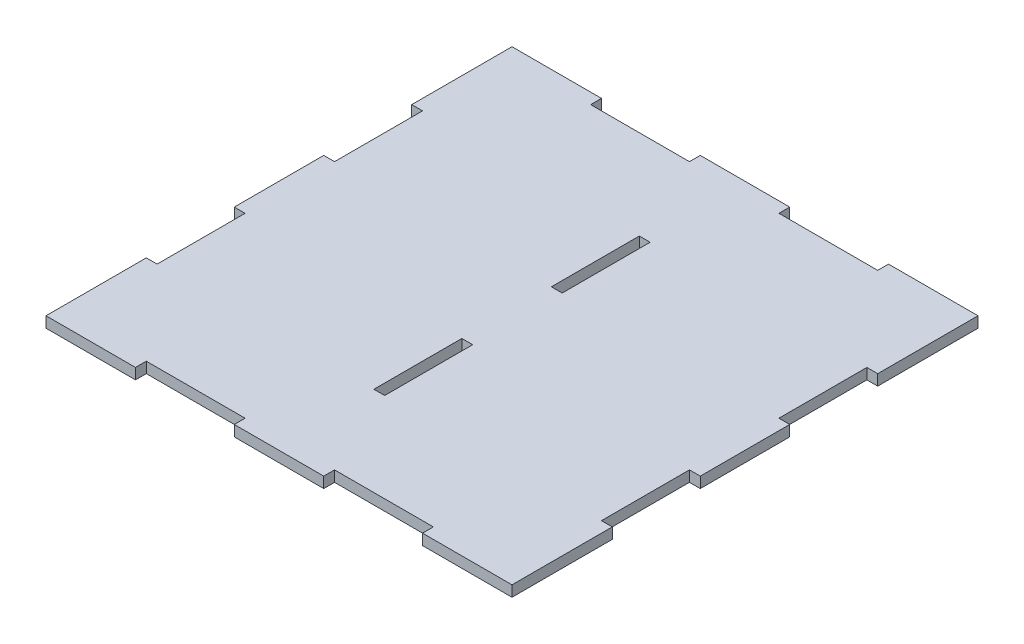
from build123d import *

# Parameters (mm, degrees)
SKETCH_1_W          = 250
SKETCH_1_H          = 250
EXTRUDE_1_DEPTH     = 5.8
CUT_EXTRUDE_1_REACH = 355.601
SKETCH_2_W          = 53
SKETCH_2_H          = 5.8
SKETCH_2_W_2        = 5.8
SKETCH_2_H_2        = 47.2


with BuildPart() as part:
    # Эскиз1 → Бобышка-Вытянуть1 (new body)
    with BuildSketch(Plane(origin=(0, 0, 0), x_dir=(1, 0, 0), z_dir=(0, 1, 0))):
        with Locations((125, 125)):
            Rectangle(SKETCH_1_W, SKETCH_1_H)
    extrude(amount=EXTRUDE_1_DEPTH)

    # Эскиз2 → Вырез-Вытянуть1 (cut, up to next)
    with BuildSketch(Plane.XZ, mode=Mode.PRIVATE) as cut_extrude_1_sk1:
        with Locations((74.5, -2.9)):
            Rectangle(SKETCH_2_W, SKETCH_2_H)
    cut_extrude_1_tool1 = extrude(cut_extrude_1_sk1.sketch, amount=-CUT_EXTRUDE_1_REACH, mode=Mode.PRIVATE) & part.part
    # Эскиз2 → Вырез-Вытянуть1 (cut, up to next)
    with BuildSketch(Plane.XZ, mode=Mode.PRIVATE) as cut_extrude_1_sk2:
        with Locations((175.5, -2.9)):
            Rectangle(SKETCH_2_W, SKETCH_2_H)
    cut_extrude_1_tool2 = extrude(cut_extrude_1_sk2.sketch, amount=-CUT_EXTRUDE_1_REACH, mode=Mode.PRIVATE) & part.part
    # Эскиз2 → Вырез-Вытянуть1 (cut, up to next)
    with BuildSketch(Plane.XZ, mode=Mode.PRIVATE) as cut_extrude_1_sk3:
        with Locations((125, -77.4)):
            Rectangle(SKETCH_2_W_2, SKETCH_2_H_2)
    cut_extrude_1_tool3 = extrude(cut_extrude_1_sk3.sketch, amount=-CUT_EXTRUDE_1_REACH, mode=Mode.PRIVATE) & part.part
    # Эскиз2 → Вырез-Вытянуть1 (cut, up to next)
    with BuildSketch(Plane.XZ, mode=Mode.PRIVATE) as cut_extrude_1_sk4:
        with Locations((2.9, -77.4)):
            Rectangle(SKETCH_2_W_2, SKETCH_2_H_2)
    cut_extrude_1_tool4 = extrude(cut_extrude_1_sk4.sketch, amount=-CUT_EXTRUDE_1_REACH, mode=Mode.PRIVATE) & part.part
    # Эскиз2 → Вырез-Вытянуть1 (cut, up to next)
    with BuildSketch(Plane.XZ, mode=Mode.PRIVATE) as cut_extrude_1_sk5:
        with Locations((2.9, -172.6)):
            Rectangle(SKETCH_2_W_2, SKETCH_2_H_2)
    cut_extrude_1_tool5 = extrude(cut_extrude_1_sk5.sketch, amount=-CUT_EXTRUDE_1_REACH, mode=Mode.PRIVATE) & part.part
    # Эскиз2 → Вырез-Вытянуть1 (cut, up to next)
    with BuildSketch(Plane.XZ, mode=Mode.PRIVATE) as cut_extrude_1_sk6:
        with Locations((125, -172.6)):
            Rectangle(SKETCH_2_W_2, SKETCH_2_H_2)
    cut_extrude_1_tool6 = extrude(cut_extrude_1_sk6.sketch, amount=-CUT_EXTRUDE_1_REACH, mode=Mode.PRIVATE) & part.part
    # Эскиз2 → Вырез-Вытянуть1 (cut, up to next)
    with BuildSketch(Plane.XZ, mode=Mode.PRIVATE) as cut_extrude_1_sk7:
        with Locations((74.5, -247.1)):
            Rectangle(SKETCH_2_W, SKETCH_2_H)
    cut_extrude_1_tool7 = extrude(cut_extrude_1_sk7.sketch, amount=-CUT_EXTRUDE_1_REACH, mode=Mode.PRIVATE) & part.part
    # Эскиз2 → Вырез-Вытянуть1 (cut, up to next)
    with BuildSketch(Plane.XZ, mode=Mode.PRIVATE) as cut_extrude_1_sk8:
        with Locations((175.5, -247.1)):
            Rectangle(SKETCH_2_W, SKETCH_2_H)
    cut_extrude_1_tool8 = extrude(cut_extrude_1_sk8.sketch, amount=-CUT_EXTRUDE_1_REACH, mode=Mode.PRIVATE) & part.part
    # Эскиз2 → Вырез-Вытянуть1 (cut, up to next)
    with BuildSketch(Plane.XZ, mode=Mode.PRIVATE) as cut_extrude_1_sk9:
        with Locations((247.1, -172.6)):
            Rectangle(SKETCH_2_W_2, SKETCH_2_H_2)
    cut_extrude_1_tool9 = extrude(cut_extrude_1_sk9.sketch, amount=-CUT_EXTRUDE_1_REACH, mode=Mode.PRIVATE) & part.part
    # Эскиз2 → Вырез-Вытянуть1 (cut, up to next)
    with BuildSketch(Plane.XZ, mode=Mode.PRIVATE) as cut_extrude_1_sk10:
        with Locations((247.1, -77.4)):
            Rectangle(SKETCH_2_W_2, SKETCH_2_H_2)
    cut_extrude_1_tool10 = extrude(cut_extrude_1_sk10.sketch, amount=-CUT_EXTRUDE_1_REACH, mode=Mode.PRIVATE) & part.part
    add(cut_extrude_1_tool1.solids().sort_by_distance((74.5, 0, -2.9))[0], mode=Mode.SUBTRACT)
    add(cut_extrude_1_tool2.solids().sort_by_distance((175.5, 0, -2.9))[0], mode=Mode.SUBTRACT)
    add(cut_extrude_1_tool3.solids().sort_by_distance((125, 0, -77.4))[0], mode=Mode.SUBTRACT)
    add(cut_extrude_1_tool4.solids().sort_by_distance((2.9, 0, -77.4))[0], mode=Mode.SUBTRACT)
    add(cut_extrude_1_tool5.solids().sort_by_distance((2.9, 0, -172.6))[0], mode=Mode.SUBTRACT)
    add(cut_extrude_1_tool6.solids().sort_by_distance((125, 0, -172.6))[0], mode=Mode.SUBTRACT)
    add(cut_extrude_1_tool7.solids().sort_by_distance((74.5, 0, -247.1))[0], mode=Mode.SUBTRACT)
    add(cut_extrude_1_tool8.solids().sort_by_distance((175.5, 0, -247.1))[0], mode=Mode.SUBTRACT)
    add(cut_extrude_1_tool9.solids().sort_by_distance((247.1, 0, -172.6))[0], mode=Mode.SUBTRACT)
    add(cut_extrude_1_tool10.solids().sort_by_distance((247.1, 0, -77.4))[0], mode=Mode.SUBTRACT)


solid = part.part
